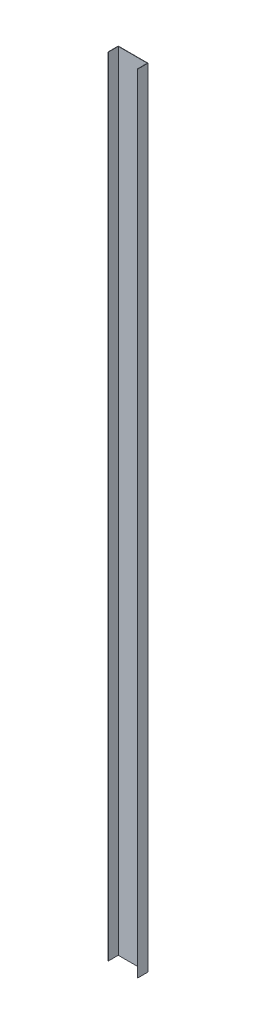
from build123d import *

# Parameters (mm, degrees)
SKETCH1_W           = 92.075
SKETCH1_H           = 31.75
BOSS_EXTRUDE1_DEPTH = 2438.4
SKETCH2_W           = 90.075
SKETCH2_H           = 31.75
CUT_EXTRUDE1_DEPTH  = 2438.4


with BuildPart() as part:
    # Sketch1 → Boss-Extrude1 (new body)
    with BuildSketch(Plane(origin=(0, 0, 0), x_dir=(1, 0, 0), z_dir=(0, 1, 0))):
        Rectangle(SKETCH1_W, SKETCH1_H)
    extrude(amount=BOSS_EXTRUDE1_DEPTH)

    # Sketch2 → Cut-Extrude1 (cut)
    with BuildSketch(Plane(origin=(0, 0, 0), x_dir=(1, 0, 0), z_dir=(0, 1, 0))):
        with Locations((0, -1)):
            Rectangle(SKETCH2_W, SKETCH2_H)
    extrude(amount=CUT_EXTRUDE1_DEPTH, mode=Mode.SUBTRACT)


solid = part.part
